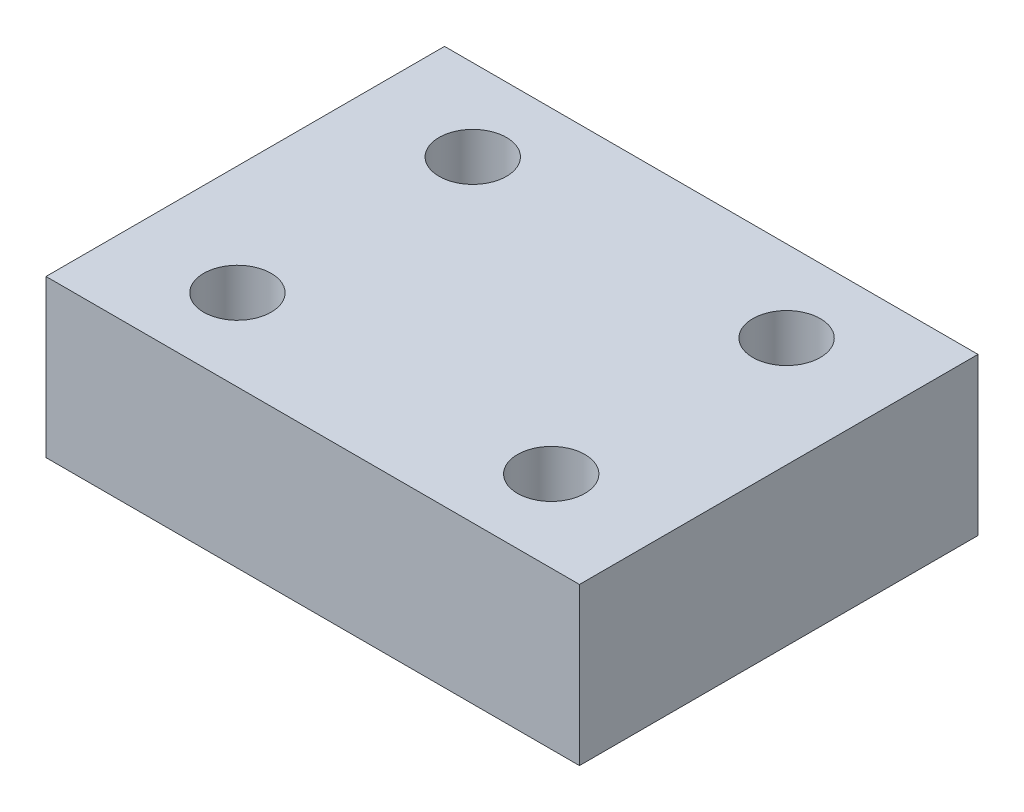
from build123d import *

# Parameters (mm, degrees)
SKETCH12_W           = 34
SKETCH12_H           = 25.4
BOSS_EXTRUDE2_DEPTH  = 10
M4_CLEARANCE_HOLE1_D = 4.3


with BuildPart() as part:
    # Sketch12 → Boss-Extrude2 (new body)
    with BuildSketch(Plane(origin=(0, 0, 0), x_dir=(1, 0, 0), z_dir=(0, 1, 0))):
        Rectangle(SKETCH12_W, SKETCH12_H)
    extrude(amount=-BOSS_EXTRUDE2_DEPTH)

    # M4 Clearance Hole1 (through all)
    with Locations(Plane(origin=(-10, 0, -7.5), x_dir=(0, 0, 1), z_dir=(0, 1, 0))):
        with Locations((0, 0), (15, 0), (15, 20), (0, 20)):
            Hole(M4_CLEARANCE_HOLE1_D / 2)


solid = part.part
